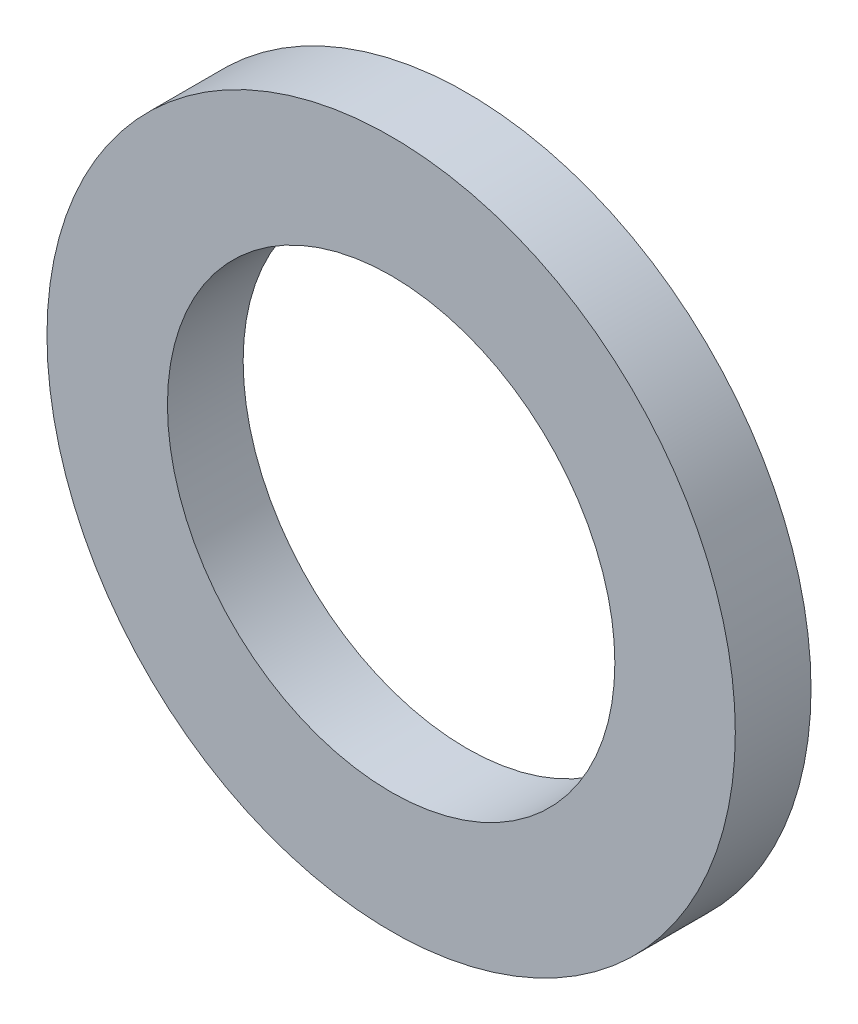
from build123d import *

# Parameters (mm, degrees)
SKETCH1_R           = 10
SKETCH1_R_2         = 6.5
BOSS_EXTRUDE1_DEPTH = 2.2


with BuildPart() as part:
    # Sketch1 → Boss-Extrude1 (new body)
    with BuildSketch(Plane.XY):
        Circle(SKETCH1_R)
        Circle(SKETCH1_R_2, mode=Mode.SUBTRACT)
    extrude(amount=BOSS_EXTRUDE1_DEPTH)


solid = part.part
